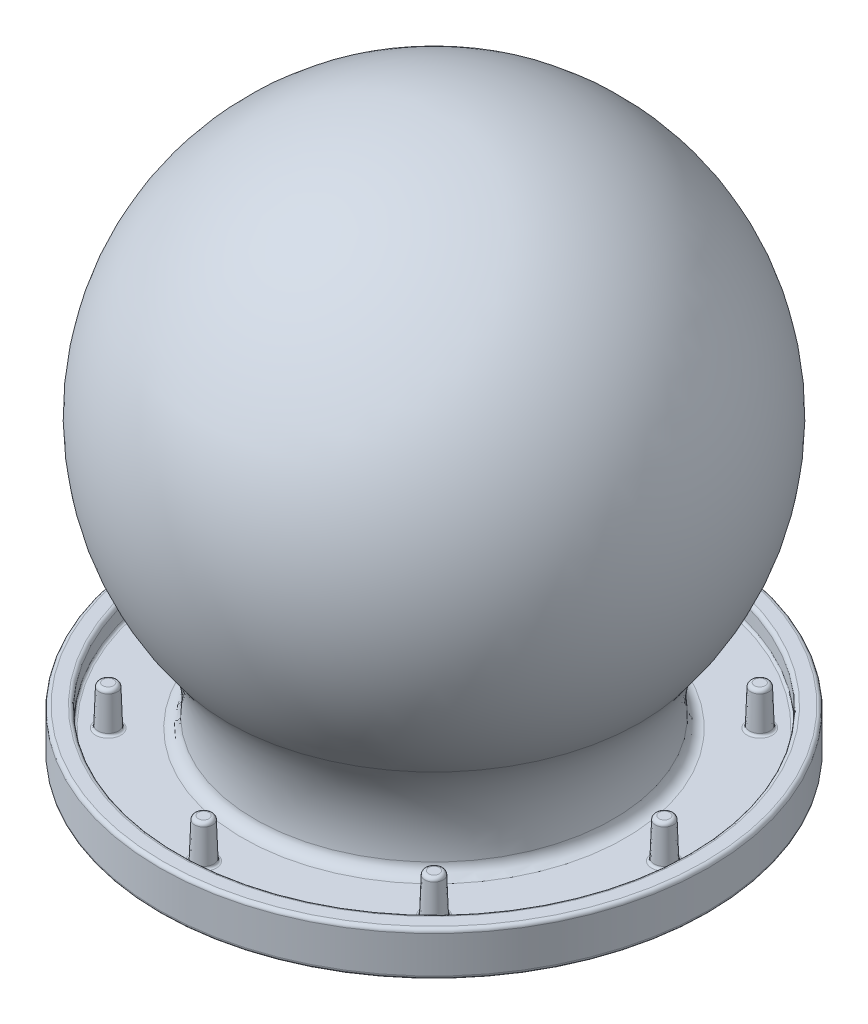
from build123d import *

# Parameters (mm, degrees)
SKETCH2_R                = 2.1
BOSS_EXTRUDE1_DEPTH      = 8
BOSS_EXTRUDE1_TAPER      = 2
FILLET1_R                = 0.75
CIRPATTERN1_COUNT        = 8
FILLET1_OF_CIRPATTERN1_R = 0.75
FILLET2_R                = 0.75
FILLET3_R                = 0.5


with BuildPart() as part:
    # Sketch1 → Revolve1 (revolve)
    with BuildSketch(Plane.XY):
        with BuildLine():
            Line((-39, 0), (-52, 0))
            Line((-52, 0), (-52, 4))
            Line((-52, 4), (-56, 4))
            Line((-56, 4), (-56, -5))
            Line((-56, -5), (-30.56550542, -5))
            Line((-30.56550542, -5), (-30.56550542, 40))
            ThreePointArc((-30.56550542, 40), (-26.328286721, 68.723502511), (-13.977606636, 95))
            ThreePointArc((-13.977606636, 95), (-7.931322199, 100.506554421), (0, 102.5))
            Line((0, 102.5), (0, 108.5))
            ThreePointArc((0, 108.5), (-48.130411806, 78.360510683), (-42.031813053, 21.900503154))
            ThreePointArc((-42.031813053, 21.900503154), (-37.310793256, 12.571686196), (-36.56550542, 2.142908712))
            ThreePointArc((-36.56550542, 2.142908712), (-37.378363357, 0.612039691), (-39, 0))
        make_face()
    revolve(axis=Axis((0, 110, 0), (0, -1, 0)))

    # Sketch2 → Boss-Extrude1 (add)
    with BuildSketch(Plane(origin=(0, 0, 0), x_dir=(-1, 0, 0), z_dir=(0, 1, 0))):
        with Locations((0, 47)):
            Circle(SKETCH2_R)
    boss_extrude1 = extrude(amount=BOSS_EXTRUDE1_DEPTH, taper=BOSS_EXTRUDE1_TAPER)

    # Fillet1
    fillet1_edges = [part.edges().sort_by_distance(p)[0] for p in [
        (1.820633844, 8, 47),
    ]]
    fillet(fillet1_edges, radius=FILLET1_R)

    # CirPattern1: Boss-Extrude1 ×8 about axis
    cirpattern1_axis = Axis((0, 0, 0), (0, 1, 0))
    for i in range(1, CIRPATTERN1_COUNT):
        add(boss_extrude1.rotate(cirpattern1_axis, i * 360 / CIRPATTERN1_COUNT))

    # Fillet1 of CirPattern1
    fillet1_of_cirpattern1_edges = [part.edges().sort_by_distance(p)[0] for p in [
        (34.521401253, 8, 31.946636179),
        (47, 8, -1.820633844),
        (31.946636179, 8, -34.521401253),
        (-1.820633844, 8, -47),
        (-34.521401253, 8, -31.946636179),
        (-47, 8, 1.820633844),
        (-31.946636179, 8, 34.521401253),
    ]]
    fillet(fillet1_of_cirpattern1_edges, radius=FILLET1_OF_CIRPATTERN1_R)

    # Fillet2
    fillet2_edges = [part.edges().sort_by_distance(p)[0] for p in [
        (56, -5, 0),
        (30.56550542, -5, 0),
        (52, 4, 0),
        (56, 4, 0),
    ]]
    fillet(fillet2_edges, radius=FILLET2_R)

    # Fillet3
    fillet3_edges = [part.edges().sort_by_distance(p)[0] for p in [
        (2.1, 0, 47),
        (34.718942956, 0, 31.749094475),
        (47, 0, -2.1),
        (31.749094475, 0, -34.718942956),
        (-2.1, 0, -47),
        (-34.718942956, 0, -31.749094475),
        (-47, 0, 2.1),
        (-31.749094475, 0, 34.718942956),
        (52, 0, 0),
    ]]
    fillet(fillet3_edges, radius=FILLET3_R)


solid = part.part
